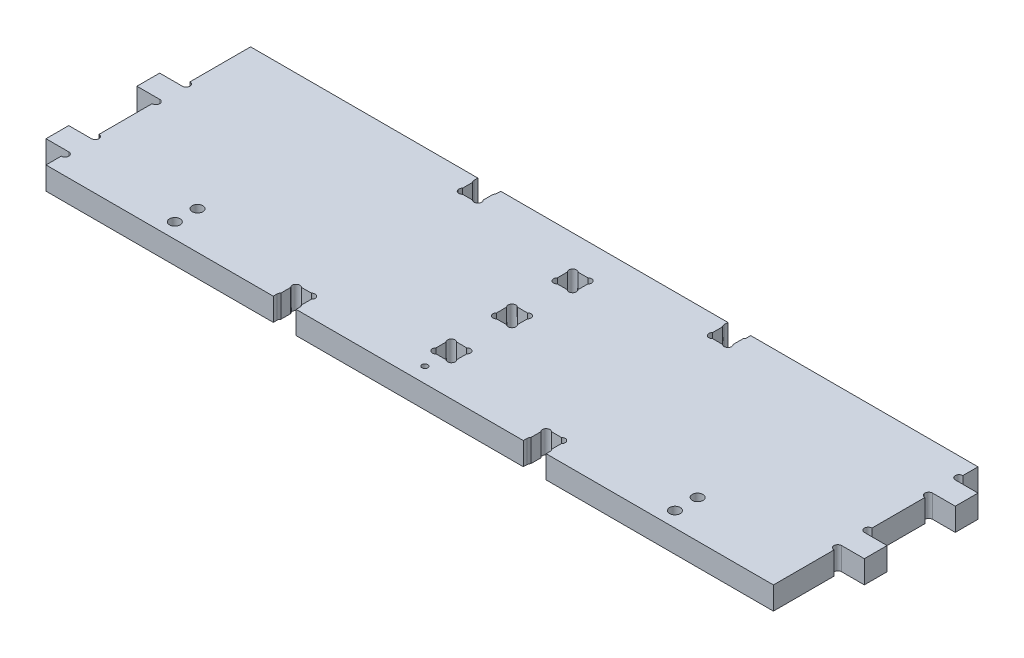
from build123d import *

# Parameters (mm, degrees)
SKETCH1_W               = 304.8
SKETCH1_H               = 171.45
BOSS_EXTRUDE1_DEPTH     = 19.05
SKETCH2_W               = 19.05
SKETCH2_H               = 19.05
BOSS_EXTRUDE2_DEPTH     = 19.05
SKETCH3_W               = 19.05
SKETCH3_H               = 19.05
CUT_EXTRUDE1_DEPTH      = 367.928913415
CUT_EXTRUDE3_DEPTH      = 367.928913415
CUT_EXTRUDE3_DEPTH_BACK = 367.928913415
CUT_EXTRUDE4_DEPTH      = 367.928913415
SKETCH10_R              = 2.413
CUT_EXTRUDE5_DEPTH      = 367.928913415
SKETCH5_W               = 17.272
SKETCH5_H               = 17.272
CUT_EXTRUDE6_DEPTH      = 367.928913415
SKETCH11_W              = 59.004774223
SKETCH11_H              = 30.493786919
SKETCH11_W_2            = 62.435284352
SKETCH11_W_3            = 77.529528921
SKETCH11_H_2            = 29.807684893
SKETCH11_H_3            = 29.121582867
BOSS_EXTRUDE4_DEPTH     = 19.05
CUT_EXTRUDE7_DEPTH      = 367.928913415
CUT_EXTRUDE8_DEPTH      = 367.928913415
SKETCH13_R              = 4.445
CUT_EXTRUDE9_DEPTH      = 6.35


with BuildPart() as part:
    # Sketch1 → Boss-Extrude1 (new body)
    with BuildSketch(Plane(origin=(0, 0, 0), x_dir=(1, 0, 0), z_dir=(0, 1, 0))):
        with Locations((-152.4, 85.725)):
            Rectangle(SKETCH1_W, SKETCH1_H)
    extrude(amount=BOSS_EXTRUDE1_DEPTH)

    # Mirror1: part across plane


with BuildPart() as part_1:
    add(part.part)
    add(part.part.mirror(Plane(origin=(0, 19.05, 0), x_dir=(0, 0, 1), z_dir=(-1, 0, 0))))

    # Sketch2 → Boss-Extrude2 (add)
    with BuildSketch(Plane(origin=(0, 19.05, 0), x_dir=(1, 0, 0), z_dir=(0, 1, 0))):
        with Locations((-314.325, 28.575)):
            Rectangle(SKETCH2_W, SKETCH2_H)
        with Locations((-314.325, 104.775)):
            Rectangle(SKETCH2_W, SKETCH2_H)
        with Locations((314.325, 142.875)):
            Rectangle(SKETCH2_W, SKETCH2_H)
        with Locations((314.325, 66.675)):
            Rectangle(SKETCH2_W, SKETCH2_H)
    extrude(amount=-BOSS_EXTRUDE2_DEPTH)

    # Sketch3 → Cut-Extrude1 (cut, symmetric)
    with BuildSketch(Plane(origin=(0, 19.05, 0), x_dir=(1, 0, 0), z_dir=(0, 1, 0))):
        with Locations((-104.775, 9.525)):
            Rectangle(SKETCH3_W, SKETCH3_H)
        with Locations((-104.775, 161.925)):
            Rectangle(SKETCH3_W, SKETCH3_H)
    cut_extrude1 = extrude(amount=CUT_EXTRUDE1_DEPTH, both=True, mode=Mode.SUBTRACT)

    # Mirror2: Cut-Extrude1 across plane
    add(cut_extrude1.mirror(Plane(origin=(0, 0, 0), x_dir=(0, 0, 1), z_dir=(1, 0, 0))), mode=Mode.SUBTRACT)

    # Sketch6 → Cut-Extrude3 (cut, two sides: drawn at the far end of the back side and taken through both)
    with BuildSketch(Plane(origin=(0, 19.05, 0), x_dir=(1, 0, 0), z_dir=(0, 1, 0)).offset(-CUT_EXTRUDE3_DEPTH_BACK)):
        with BuildLine():
            Line((-114.3, 166.959871939), (-114.3, 156.890128061))
            ThreePointArc((-114.3, 156.890128061), (-114.3, 152.4), (-109.809871939, 152.4))
            Line((-109.809871939, 152.4), (-99.740128061, 152.4))
            ThreePointArc((-99.740128061, 152.4), (-95.25, 152.4), (-95.25, 156.890128061))
            Line((-95.25, 156.890128061), (-95.25, 166.959871939))
            Line((-95.25, 166.959871939), (-114.3, 166.959871939))
        make_face()
        with BuildLine():
            ThreePointArc((114.3, 156.890128061), (114.3, 152.4), (109.809871939, 152.4))
            Line((109.809871939, 152.4), (99.740128061, 152.4))
            ThreePointArc((99.740128061, 152.4), (95.25, 152.4), (95.25, 156.890128061))
            Line((95.25, 156.890128061), (95.25, 166.959871939))
            Line((95.25, 166.959871939), (114.3, 166.959871939))
            Line((114.3, 166.959871939), (114.3, 156.890128061))
        make_face()
        with BuildLine():
            ThreePointArc((95.25, 14.559871939), (95.25, 19.05), (99.740128061, 19.05))
            Line((99.740128061, 19.05), (109.809871939, 19.05))
            ThreePointArc((109.809871939, 19.05), (114.3, 19.05), (114.3, 14.559871939))
            Line((114.3, 14.559871939), (114.3, 4.490128061))
            Line((114.3, 4.490128061), (95.25, 4.490128061))
            Line((95.25, 4.490128061), (95.25, 14.559871939))
        make_face()
        with BuildLine():
            Line((-95.25, 4.490128061), (-95.25, 14.559871939))
            ThreePointArc((-95.25, 14.559871939), (-95.25, 19.05), (-99.740128061, 19.05))
            Line((-99.740128061, 19.05), (-109.809871939, 19.05))
            ThreePointArc((-109.809871939, 19.05), (-114.3, 19.05), (-114.3, 14.559871939))
            Line((-114.3, 14.559871939), (-114.3, 4.490128061))
            Line((-114.3, 4.490128061), (-95.25, 4.490128061))
        make_face()
    extrude(amount=CUT_EXTRUDE3_DEPTH + CUT_EXTRUDE3_DEPTH_BACK, mode=Mode.SUBTRACT)

    # Sketch8 → Cut-Extrude4 (cut, through all)
    with BuildSketch(Plane(origin=(0, 19.05, 0), x_dir=(1, 0, 0), z_dir=(0, 1, 0))):
        with BuildLine():
            Line((-304.8, 120.65), (-304.8, 114.3))
            ThreePointArc((-304.8, 114.3), (-301.625, 117.475), (-304.8, 120.65))
        make_face()
        with BuildLine():
            Line((-304.8, 95.25), (-304.8, 88.9))
            ThreePointArc((-304.8, 88.9), (-301.625, 92.075), (-304.8, 95.25))
        make_face()
        with BuildLine():
            Line((-304.8, 44.45), (-304.8, 38.1))
            ThreePointArc((-304.8, 38.1), (-301.625, 41.275), (-304.8, 44.45))
        make_face()
        with BuildLine():
            Line((-304.8, 19.05), (-304.8, 12.7))
            ThreePointArc((-304.8, 12.7), (-301.625, 15.875), (-304.8, 19.05))
        make_face()
        with BuildLine():
            ThreePointArc((304.8, 158.75), (301.625, 155.575), (304.8, 152.4))
            Line((304.8, 152.4), (304.8, 158.75))
        make_face()
        with BuildLine():
            ThreePointArc((304.8, 133.35), (301.625, 130.175), (304.8, 127))
            Line((304.8, 127), (304.8, 133.35))
        make_face()
        with BuildLine():
            ThreePointArc((304.8, 57.15), (301.625, 53.975), (304.8, 50.8))
            Line((304.8, 50.8), (304.8, 57.15))
        make_face()
        with BuildLine():
            ThreePointArc((304.8, 82.55), (301.625, 79.375), (304.8, 76.2))
            Line((304.8, 76.2), (304.8, 82.55))
        make_face()
    extrude(amount=-CUT_EXTRUDE4_DEPTH, mode=Mode.SUBTRACT)

    # Sketch10 → Cut-Extrude5 (cut, through all)
    with BuildSketch(Plane.XZ):
        with Locations(Location((-209.55, -12.7, 0), (0, 0, 270))):
            Circle(SKETCH10_R)
        with Locations(Location((-209.55, -31.75, 0), (0, 0, 270))):
            Circle(SKETCH10_R)
        with Locations(Location((0, -12.7, 0), (0, 0, 270))):
            Circle(SKETCH10_R)
        with Locations(Location((0, -31.75, 0), (0, 0, 270))):
            Circle(SKETCH10_R)
        with Locations(Location((209.55, -12.7, 0), (0, 0, 270))):
            Circle(SKETCH10_R)
        with Locations(Location((209.55, -31.75, 0), (0, 0, 270))):
            Circle(SKETCH10_R)
    extrude(amount=-CUT_EXTRUDE5_DEPTH, mode=Mode.SUBTRACT)

    # Sketch5 → Cut-Extrude6 (cut, through all)
    with BuildSketch(Plane(origin=(0, 19.05, 0), x_dir=(1, 0, 0), z_dir=(0, 1, 0))):
        with BuildLine():
            ThreePointArc((-8.636, 43.561), (-9.56593597, 41.31593597), (-8.636, 39.070871939))
            Line((-8.636, 39.070871939), (-8.636, 43.561))
        make_face()
        with Locations((0, 34.925)):
            Rectangle(SKETCH5_W, SKETCH5_H)
        with BuildLine():
            ThreePointArc((-4.145871939, 43.561), (-6.39093597, 44.49093597), (-8.636, 43.561))
            Line((-8.636, 43.561), (-4.145871939, 43.561))
        make_face()
        with BuildLine():
            ThreePointArc((-8.636, 30.779128061), (-9.56593597, 28.53406403), (-8.636, 26.289))
            Line((-8.636, 26.289), (-8.636, 30.779128061))
        make_face()
        with BuildLine():
            Line((-4.145871939, 26.289), (-8.636, 26.289))
            ThreePointArc((-8.636, 26.289), (-6.39093597, 25.35906403), (-4.145871939, 26.289))
        make_face()
        with BuildLine():
            Line((8.636, 26.289), (4.145871939, 26.289))
            ThreePointArc((4.145871939, 26.289), (6.39093597, 25.35906403), (8.636, 26.289))
        make_face()
        with BuildLine():
            Line((8.636, 30.779128061), (8.636, 26.289))
            ThreePointArc((8.636, 26.289), (9.56593597, 28.53406403), (8.636, 30.779128061))
        make_face()
        with BuildLine():
            Line((8.636, 43.561), (8.636, 39.070871939))
            ThreePointArc((8.636, 39.070871939), (9.56593597, 41.31593597), (8.636, 43.561))
        make_face()
        with BuildLine():
            ThreePointArc((8.636, 43.561), (6.39093597, 44.49093597), (4.145871939, 43.561))
            Line((4.145871939, 43.561), (8.636, 43.561))
        make_face()
        with Locations((0, 85.725)):
            Rectangle(SKETCH5_W, SKETCH5_H)
        with BuildLine():
            ThreePointArc((-8.636, 81.579128061), (-9.56593597, 79.33406403), (-8.636, 77.089))
            Line((-8.636, 77.089), (-8.636, 81.579128061))
        make_face()
        with BuildLine():
            Line((8.636, 77.089), (4.145871939, 77.089))
            ThreePointArc((4.145871939, 77.089), (6.39093597, 76.15906403), (8.636, 77.089))
        make_face()
        with BuildLine():
            Line((8.636, 81.579128061), (8.636, 77.089))
            ThreePointArc((8.636, 77.089), (9.56593597, 79.33406403), (8.636, 81.579128061))
        make_face()
        with BuildLine():
            Line((-4.145871939, 77.089), (-8.636, 77.089))
            ThreePointArc((-8.636, 77.089), (-6.39093597, 76.15906403), (-4.145871939, 77.089))
        make_face()
        with BuildLine():
            ThreePointArc((-8.636, 94.361), (-9.56593597, 92.11593597), (-8.636, 89.870871939))
            Line((-8.636, 89.870871939), (-8.636, 94.361))
        make_face()
        with BuildLine():
            ThreePointArc((-4.145871939, 94.361), (-6.39093597, 95.29093597), (-8.636, 94.361))
            Line((-8.636, 94.361), (-4.145871939, 94.361))
        make_face()
        with BuildLine():
            Line((8.636, 94.361), (8.636, 89.870871939))
            ThreePointArc((8.636, 89.870871939), (9.56593597, 92.11593597), (8.636, 94.361))
        make_face()
        with BuildLine():
            ThreePointArc((8.636, 94.361), (6.39093597, 95.29093597), (4.145871939, 94.361))
            Line((4.145871939, 94.361), (8.636, 94.361))
        make_face()
        with Locations((0, 136.525)):
            Rectangle(SKETCH5_W, SKETCH5_H)
        with BuildLine():
            ThreePointArc((-8.636, 145.161), (-9.56593597, 142.91593597), (-8.636, 140.670871939))
            Line((-8.636, 140.670871939), (-8.636, 145.161))
        make_face()
        with BuildLine():
            ThreePointArc((-4.145871939, 145.161), (-6.39093597, 146.09093597), (-8.636, 145.161))
            Line((-8.636, 145.161), (-4.145871939, 145.161))
        make_face()
        with BuildLine():
            ThreePointArc((8.636, 145.161), (6.39093597, 146.09093597), (4.145871939, 145.161))
            Line((4.145871939, 145.161), (8.636, 145.161))
        make_face()
        with BuildLine():
            Line((8.636, 145.161), (8.636, 140.670871939))
            ThreePointArc((8.636, 140.670871939), (9.56593597, 142.91593597), (8.636, 145.161))
        make_face()
        with BuildLine():
            Line((8.636, 132.379128061), (8.636, 127.889))
            ThreePointArc((8.636, 127.889), (9.56593597, 130.13406403), (8.636, 132.379128061))
        make_face()
        with BuildLine():
            Line((8.636, 127.889), (4.145871939, 127.889))
            ThreePointArc((4.145871939, 127.889), (6.39093597, 126.95906403), (8.636, 127.889))
        make_face()
        with BuildLine():
            Line((-4.145871939, 127.889), (-8.636, 127.889))
            ThreePointArc((-8.636, 127.889), (-6.39093597, 126.95906403), (-4.145871939, 127.889))
        make_face()
        with BuildLine():
            ThreePointArc((-8.636, 132.379128061), (-9.56593597, 130.13406403), (-8.636, 127.889))
            Line((-8.636, 127.889), (-8.636, 132.379128061))
        make_face()
    extrude(amount=-CUT_EXTRUDE6_DEPTH, mode=Mode.SUBTRACT)

    # Sketch11 → Boss-Extrude4 (add)
    with BuildSketch(Plane(origin=(0, 19.05, 0), x_dir=(1, 0, 0), z_dir=(0, 1, 0))):
        with Locations((-104.28750793, 15.24689346)):
            Rectangle(SKETCH11_W, SKETCH11_H)
        with Locations((100.513946787, 15.24689346)):
            Rectangle(SKETCH11_W_2, SKETCH11_H)
        with Locations((108.061069072, 156.546157553)):
            Rectangle(SKETCH11_W_3, SKETCH11_H_2)
        with Locations((-104.28750793, 156.889208567)):
            Rectangle(SKETCH11_W, SKETCH11_H_3)
    extrude(amount=-BOSS_EXTRUDE4_DEPTH)

    # Sketch12 → Cut-Extrude7 (cut, through all)
    with BuildSketch(Plane(origin=(0, 19.05, 0), x_dir=(1, 0, 0), z_dir=(0, 1, 0))):
        with BuildLine():
            ThreePointArc((-113.411, 5.42006403), (-114.099253485, 4.390019898), (-114.34093597, 3.175))
            Line((-114.34093597, 3.175), (-114.34093597, 0))
            Line((-114.34093597, 0), (-95.20906403, 0))
            Line((-95.20906403, 0), (-95.20906403, 3.175))
            ThreePointArc((-95.20906403, 3.175), (-95.450746515, 4.390019898), (-96.139, 5.42006403))
            Line((-96.139, 5.42006403), (-96.139, 13.711807909))
            ThreePointArc((-96.139, 13.711807909), (-96.139, 18.20193597), (-100.629128061, 18.20193597))
            Line((-100.629128061, 18.20193597), (-108.920871939, 18.20193597))
            ThreePointArc((-108.920871939, 18.20193597), (-113.411, 18.20193597), (-113.411, 13.711807909))
            Line((-113.411, 13.711807909), (-113.411, 5.42006403))
        make_face()
        with BuildLine():
            Line((114.34093597, 0), (114.34093597, 3.175))
            ThreePointArc((114.34093597, 3.175), (114.099253485, 4.390019898), (113.411, 5.42006403))
            Line((113.411, 5.42006403), (113.411, 13.711807909))
            ThreePointArc((113.411, 13.711807909), (113.411, 18.20193597), (108.920871939, 18.20193597))
            Line((108.920871939, 18.20193597), (100.629128061, 18.20193597))
            ThreePointArc((100.629128061, 18.20193597), (96.139, 18.20193597), (96.139, 13.711807909))
            Line((96.139, 13.711807909), (96.139, 5.42006403))
            ThreePointArc((96.139, 5.42006403), (95.450746515, 4.390019898), (95.20906403, 3.175))
            Line((95.20906403, 3.175), (95.20906403, 0))
            Line((95.20906403, 0), (114.34093597, 0))
        make_face()
        with BuildLine():
            Line((113.411, 157.738192091), (113.411, 170.52006403))
            Line((113.411, 170.52006403), (96.139, 170.52006403))
            ThreePointArc((96.139, 170.52006403), (95.20906403, 168.275), (96.139, 166.02993597))
            Line((96.139, 166.02993597), (96.139, 157.738192091))
            ThreePointArc((96.139, 157.738192091), (96.139, 153.24806403), (100.629128061, 153.24806403))
            Line((100.629128061, 153.24806403), (108.920871939, 153.24806403))
            ThreePointArc((108.920871939, 153.24806403), (113.411, 153.24806403), (113.411, 157.738192091))
        make_face()
        with BuildLine():
            Line((-114.34093597, 171.45), (-114.34093597, 168.275))
            ThreePointArc((-114.34093597, 168.275), (-114.099253485, 167.059980102), (-113.411, 166.02993597))
            Line((-113.411, 166.02993597), (-113.411, 157.738192091))
            ThreePointArc((-113.411, 157.738192091), (-113.411, 153.24806403), (-108.920871939, 153.24806403))
            Line((-108.920871939, 153.24806403), (-100.629128061, 153.24806403))
            ThreePointArc((-100.629128061, 153.24806403), (-96.139, 153.24806403), (-96.139, 157.738192091))
            Line((-96.139, 157.738192091), (-96.139, 166.02993597))
            ThreePointArc((-96.139, 166.02993597), (-95.450746515, 167.059980102), (-95.20906403, 168.275))
            Line((-95.20906403, 168.275), (-95.20906403, 171.45))
            Line((-95.20906403, 171.45), (-114.34093597, 171.45))
        make_face()
    extrude(amount=-CUT_EXTRUDE7_DEPTH, mode=Mode.SUBTRACT)

    # Sketch12<3> → Cut-Extrude8 (cut, through all)
    with BuildSketch(Plane(origin=(0, 19.05, 0), x_dir=(1, 0, 0), z_dir=(0, 1, 0))):
        with BuildLine():
            ThreePointArc((96.139, 170.52006403), (97.169044133, 171.208317516), (98.38406403, 171.45))
            Line((98.38406403, 171.45), (95.20906403, 171.45))
            Line((95.20906403, 171.45), (95.20906403, 168.275))
            ThreePointArc((95.20906403, 168.275), (95.450746515, 169.490019898), (96.139, 170.52006403))
        make_face()
        with BuildLine():
            Line((96.139, 170.52006403), (100.629128061, 170.52006403))
            ThreePointArc((100.629128061, 170.52006403), (99.599083928, 171.208317516), (98.38406403, 171.45))
            ThreePointArc((98.38406403, 171.45), (97.169044133, 171.208317516), (96.139, 170.52006403))
        make_face()
        with BuildLine():
            Line((100.629128061, 170.52006403), (108.920871939, 170.52006403))
            ThreePointArc((108.920871939, 170.52006403), (109.950916072, 171.208317516), (111.16593597, 171.45))
            Line((111.16593597, 171.45), (98.38406403, 171.45))
            ThreePointArc((98.38406403, 171.45), (99.599083928, 171.208317516), (100.629128061, 170.52006403))
        make_face()
        with BuildLine():
            Line((108.920871939, 170.52006403), (113.411, 170.52006403))
            ThreePointArc((113.411, 170.52006403), (112.380955867, 171.208317516), (111.16593597, 171.45))
            ThreePointArc((111.16593597, 171.45), (109.950916072, 171.208317516), (108.920871939, 170.52006403))
        make_face()
        with BuildLine():
            ThreePointArc((111.16593597, 171.45), (112.380955867, 171.208317516), (113.411, 170.52006403))
            ThreePointArc((113.411, 170.52006403), (114.099253485, 169.490019898), (114.34093597, 168.275))
            Line((114.34093597, 168.275), (114.34093597, 171.45))
            Line((114.34093597, 171.45), (111.16593597, 171.45))
        make_face()
        with BuildLine():
            ThreePointArc((114.34093597, 168.275), (114.099253485, 169.490019898), (113.411, 170.52006403))
            Line((113.411, 170.52006403), (113.411, 166.02993597))
            ThreePointArc((113.411, 166.02993597), (114.099253485, 167.059980102), (114.34093597, 168.275))
        make_face()
    extrude(amount=-CUT_EXTRUDE8_DEPTH, mode=Mode.SUBTRACT)

    # Sketch13 → Cut-Extrude9 (cut)
    with BuildSketch(Plane(origin=(0, 19.05, 0), x_dir=(1, 0, 0), z_dir=(0, 1, 0))):
        with Locations(Location((-209.55, 12.7, 0), (0, 0, 270))):
            Circle(SKETCH13_R)
        with Locations(Location((-209.55, 31.75, 0), (0, 0, 270))):
            Circle(SKETCH13_R)
        with Locations(Location((209.55, 31.75, 0), (0, 0, 270))):
            Circle(SKETCH13_R)
        with Locations(Location((209.55, 12.7, 0), (0, 0, 270))):
            Circle(SKETCH13_R)
    extrude(amount=-CUT_EXTRUDE9_DEPTH, mode=Mode.SUBTRACT)


solid = part_1.part
